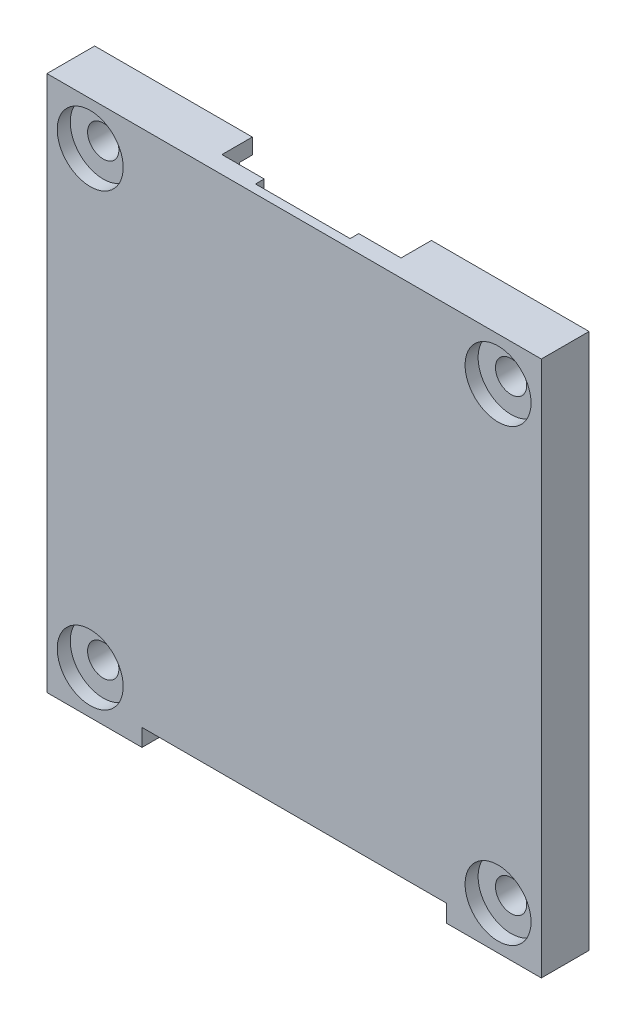
from build123d import *

# Parameters (mm, degrees)
SKETCH_1_W               = 56.974706629
SKETCH_1_H               = 61.774716789
EXTRUDE_1_DEPTH          = 4
CUT_EXTRUDE_1_DEPTH      = 0.2
CUT_EXTRUDE_1_DEPTH_BACK = 2
SKETCH_2_W               = 4.870408941
SKETCH_2_H               = 4.364574549
SKETCH_2_H_2             = 4.39003302
SKETCH_2_W_2             = 4.274676149
SKETCH_2_H_3             = 2.486588773
SKETCH_3_W               = 10.898481077
SKETCH_3_H               = 8.614292609
CUT_EXTRUDE_2_DEPTH      = 3
SKETCH_4_W               = 9.753086106
SKETCH_4_H               = 5.329565659
CUT_EXTRUDE_3_DEPTH      = 2
SKETCH_5_R               = 1.5
SKETCH_5_R_2             = 1.35
CUT_EXTRUDE_4_DEPTH      = 2
SKETCH_6_W               = 3.227303784
SKETCH_6_H               = 21.254043688
CUT_EXTRUDE_5_DEPTH      = 2
SKETCH_7_R               = 1.55
SKETCH_7_R_2             = 1.3
SKETCH_7_R_3             = 0.9
SKETCH_7_W               = 3.1999746
SKETCH_7_H               = 1.7000254
CUT_EXTRUDE_8_DEPTH      = 3
SKETCH_9_W               = 4.274676149
SKETCH_9_H               = 2.586588773
SKETCH_9_W_2             = 5.070408941
SKETCH_9_H_2             = 4.471976124
SKETCH_9_H_3             = 4.444036068
CUT_EXTRUDE_9_DEPTH      = 2
SKETCH_10_W              = 35.063093726
SKETCH_10_H              = 2
CUT_EXTRUDE_10_DEPTH     = 47.363645154
EXTRUDE_2_DEPTH          = 1.5
SKETCH_12_R              = 1.8
CUT_EXTRUDE_11_DEPTH     = 5
SKETCH_13_R              = 3.8
CUT_EXTRUDE_12_DEPTH     = 1.5


with BuildPart() as part:
    # 草图1 → 凸台-拉伸1 (new body)
    with BuildSketch(Plane.XY):
        with Locations((3.938246432, -2.008964698)):
            Rectangle(SKETCH_1_W, SKETCH_1_H)
    extrude(amount=EXTRUDE_1_DEPTH)

    # 草图2 → 切除-拉伸1 (cut, two sides: drawn at the far end of the back side and taken through both)
    with BuildSketch(Plane(origin=(0, 0, 0), x_dir=(-1, 0, 0), z_dir=(0, 0, -1)).offset(-CUT_EXTRUDE_1_DEPTH_BACK)):
        with Locations((-11.822691441, 26.696106422)):
            Rectangle(SKETCH_2_W, SKETCH_2_H)
        with Locations((3.946198578, 26.683377186)):
            Rectangle(SKETCH_2_W, SKETCH_2_H_2)
        with Locations((4.061768809, 22.841086102)):
            Rectangle(SKETCH_2_W_2, SKETCH_2_H_3)
        with Locations((-11.938261672, 22.841086102)):
            Rectangle(SKETCH_2_W_2, SKETCH_2_H_3)
    extrude(amount=CUT_EXTRUDE_1_DEPTH + CUT_EXTRUDE_1_DEPTH_BACK, mode=Mode.SUBTRACT)

    # 草图3 → 切除-拉伸2 (cut)
    with BuildSketch(Plane(origin=(0, 0, 0), x_dir=(-1, 0, 0), z_dir=(0, 0, -1))):
        with Locations((-3.938246432, 24.571247392)):
            Rectangle(SKETCH_3_W, SKETCH_3_H)
    extrude(amount=-CUT_EXTRUDE_2_DEPTH, mode=Mode.SUBTRACT)

    # 草图4 → 切除-拉伸3 (cut)
    with BuildSketch(Plane(origin=(0, 0, 0), x_dir=(-1, 0, 0), z_dir=(0, 0, -1))):
        with Locations((-3.938246431, 17.599318258)):
            Rectangle(SKETCH_4_W, SKETCH_4_H)
    extrude(amount=-CUT_EXTRUDE_3_DEPTH, mode=Mode.SUBTRACT)

    # 草图5 → 切除-拉伸4 (cut)
    with BuildSketch(Plane(origin=(0, 0, 0), x_dir=(-1, 0, 0), z_dir=(0, 0, -1))):
        with Locations((-16.438279451, 21.841022601)):
            Circle(SKETCH_5_R)
        with Locations((-17.438279451, 24.341149602)):
            Circle(SKETCH_5_R_2)
        with Locations((-23.438279451, 21.841022601)):
            Circle(SKETCH_5_R)
        with Locations((-22.438279451, 24.341149602)):
            Circle(SKETCH_5_R_2)
        with Locations((8.561786589, 21.841022601)):
            Circle(SKETCH_5_R)
        with Locations((9.561786589, 24.341149602)):
            Circle(SKETCH_5_R_2)
        with Locations((15.561786589, 21.841022601)):
            Circle(SKETCH_5_R)
        with Locations((14.561786589, 24.341149602)):
            Circle(SKETCH_5_R_2)
    extrude(amount=-CUT_EXTRUDE_4_DEPTH, mode=Mode.SUBTRACT)

    # 草图6 → 切除-拉伸5 (cut)
    with BuildSketch(Plane(origin=(0, 0, 0), x_dir=(-1, 0, 0), z_dir=(0, 0, -1))):
        with Locations((20.935454991, 9.473060955)):
            Rectangle(SKETCH_6_W, SKETCH_6_H)
        with Locations((-28.811947854, 9.473058415)):
            Rectangle(SKETCH_6_W, SKETCH_6_H)
    extrude(amount=-CUT_EXTRUDE_5_DEPTH, mode=Mode.SUBTRACT)

    # 草图7 → 切除-拉伸8 (cut)
    with BuildSketch(Plane(origin=(0, 0, 0), x_dir=(-1, 0, 0), z_dir=(0, 0, -1))):
        with Locations((-1.438416122, -17.815866469)):
            Circle(SKETCH_7_R)
        with Locations((-6.438246431, -17.816005593)):
            Circle(SKETCH_7_R)
        with Locations((-9.438246431, -27.816005593)):
            Circle(SKETCH_7_R_2)
        with Locations((1.561753569, -27.816005593)):
            Circle(SKETCH_7_R_2)
        with Locations((11.054412954, -4.408667518)):
            Circle(SKETCH_7_R_3)
        with Locations((11.054412954, -9.408769118)):
            Circle(SKETCH_7_R_3)
        with Locations((11.804809195, -13.108944379)):
            Rectangle(SKETCH_7_W, SKETCH_7_H)
        with Locations((11.804809195, -17.908969779)):
            Rectangle(SKETCH_7_W, SKETCH_7_H)
        with Locations((11.804809195, -22.708969779)):
            Rectangle(SKETCH_7_W, SKETCH_7_H)
    extrude(amount=-CUT_EXTRUDE_8_DEPTH, mode=Mode.SUBTRACT)

    # 草图9 → 切除-拉伸9 (cut)
    with BuildSketch(Plane(origin=(0, 0, 0), x_dir=(-1, 0, 0), z_dir=(0, 0, -1))):
        with Locations((9.061778969, -26.409012958)):
            Rectangle(SKETCH_9_W, SKETCH_9_H)
        with Locations((8.946208738, -30.660335031)):
            Rectangle(SKETCH_9_W_2, SKETCH_9_H_2)
        with Locations((-16.938271831, -26.409012958)):
            Rectangle(SKETCH_9_W, SKETCH_9_H)
        with Locations((-16.822701601, -30.674305059)):
            Rectangle(SKETCH_9_W_2, SKETCH_9_H_3)
    extrude(amount=-CUT_EXTRUDE_9_DEPTH, mode=Mode.SUBTRACT)

    # 草图10 → 切除-拉伸10 (cut, through all)
    with BuildSketch(Plane(origin=(0, 0, 0), x_dir=(-1, 0, 0), z_dir=(0, 0, -1))):
        with Locations((-3.938119431, -31.896323093)):
            Rectangle(SKETCH_10_W, SKETCH_10_H)
    extrude(amount=-CUT_EXTRUDE_10_DEPTH, mode=Mode.SUBTRACT)

    # 草图11 → 凸台-拉伸2 (add)
    with BuildSketch(Plane(origin=(0, 0, 0), x_dir=(-1, 0, 0), z_dir=(0, 0, -1))):
        Polygon((6.381403048, 28.878393696), (24.549106883, 28.878393696), (24.549106883, -32.896323093), (13.593427432, -32.896323093), (13.593427432, -31.096323093), (14.493427432, -31.096323093), (14.493427432, -32.096323093), (23.749106883, -32.096323093), (23.749106883, -25.485957333), (22.749106883, -25.485957333), (22.749106883, -24.585957333), (23.749106883, -24.585957333), (23.749106883, -11.231931425), (22.749106883, -11.231931425), (22.749106883, -10.331931425), (23.749106883, -10.331931425), (23.749106883, 28.078393696), (17.038926543, 28.078393696), (17.038926543, 27.078393696), (16.138926543, 27.078393696), (16.138926543, 28.078393696), (7.981403048, 28.078393696), (7.981403048, 27.078393696), (6.381403048, 27.078393696), align=None)
        Polygon((-32.425599746, 28.878393696), (-32.425599746, -32.896323093), (-21.469666294, -32.896323093), (-21.469666294, -31.096323093), (-22.369666294, -31.096323093), (-22.369666294, -32.096323093), (-31.625599746, -32.096323093), (-31.625599746, -3.618963429), (-30.625599746, -3.618963429), (-30.625599746, 0.181036571), (-31.625599746, 0.181036571), (-31.625599746, 28.078393696), (-24.915165405, 28.078393696), (-24.915165405, 27.078393696), (-24.015165405, 27.078393696), (-24.015165405, 28.078393696), (-15.857895911, 28.078393696), (-15.857895911, 27.078393696), (-14.257895911, 27.078393696), (-14.257895911, 28.878393696), align=None)
    extrude(amount=EXTRUDE_2_DEPTH)

    # 草图12 → 切除-拉伸11 (cut)
    with BuildSketch(Plane(origin=(0, 0, 0), x_dir=(-1, 0, 0), z_dir=(0, 0, -1))):
        with Locations((19.561801829, 23.891088641)):
            Circle(SKETCH_12_R)
        with Locations((19.561801829, -27.909015499)):
            Circle(SKETCH_12_R)
        with Locations((-27.438294692, -27.909015499)):
            Circle(SKETCH_12_R)
        with Locations((-27.438294692, 23.891088641)):
            Circle(SKETCH_12_R)
    extrude(amount=-CUT_EXTRUDE_11_DEPTH, mode=Mode.SUBTRACT)

    # 草图13 → 切除-拉伸12 (cut)
    with BuildSketch(Plane.XY.offset(4)):
        with Locations((-19.561801829, -27.909015499)):
            Circle(SKETCH_13_R)
        with Locations((27.438294692, -27.909015499)):
            Circle(SKETCH_13_R)
        with Locations((27.438294692, 23.891088641)):
            Circle(SKETCH_13_R)
        with Locations((-19.561801829, 23.891088641)):
            Circle(SKETCH_13_R)
    extrude(amount=-CUT_EXTRUDE_12_DEPTH, mode=Mode.SUBTRACT)


solid = part.part
